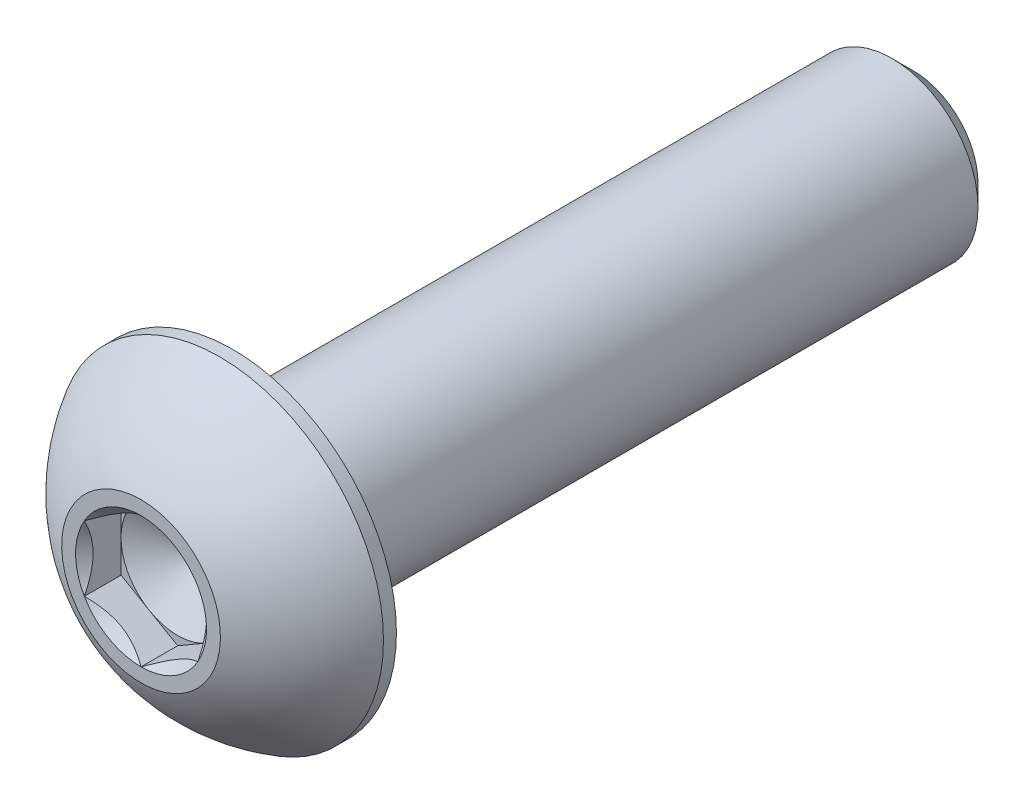
from build123d import *

# Parameters (mm, degrees)
CUT_EXTRUDE1_START = 9.78154
CUT_EXTRUDE1_DEPTH = 3.821845556


with BuildPart() as part:
    # Sketch2 → Revolve1 (revolve)
    with BuildSketch(Plane(origin=(0, 0, 0), x_dir=(0, 0, -1), z_dir=(1, 0, 0)), mode=Mode.PRIVATE) as revolve1_sk:
        with BuildLine():
            Line((-10.8077, 1.5875), (-10.8077, 2.2225))
            ThreePointArc((-10.8077, 2.2225), (-9.892752118, 3.57733025), (-8.605157143, 4.5847))
            Line((-8.605157143, 4.5847), (-8.2423, 4.5847))
            Line((-8.2423, 4.5847), (-8.2423, 2.413))
            Line((-8.2423, 2.413), (10.2123875, 2.413))
            Line((10.2123875, 2.413), (10.8077, 1.8176875))
            Line((10.8077, 1.8176875), (10.8077, 0))
            Line((10.8077, 0), (-8.864996448, 0))
            Line((-8.864996448, 0), (-9.78154, 1.5875))
            Line((-9.78154, 1.5875), (-10.8077, 1.5875))
        make_face()
    revolve(revolve1_sk.sketch.rotate(Axis((0, 0, 10.8077), (0, 0, -1)), 90), axis=Axis((0, 0, 10.8077), (0, 0, -1)))

    # Sketch3 → Cut-Extrude1 (cut, through all)
    with BuildSketch(Plane.XY.offset(CUT_EXTRUDE1_START)):
        Polygon((0, 1.833087105), (-1.5875, 0.916543552), (-1.5875, -0.916543552), (0, -1.833087105), (1.5875, -0.916543552), (1.5875, 0.916543552), align=None)
    extrude(amount=CUT_EXTRUDE1_DEPTH, mode=Mode.SUBTRACT)

    # Cut-Extrude2 cone 1 section (through the dimple's axis) → Cut-Extrude2 (revolve, cut)
    with BuildSketch(Plane(origin=(0, 0, 10.8077), x_dir=(0, -1, 0), z_dir=(1, 0, 0))):
        Polygon((0, 0), (1.833087105, 0), (0, 1.833087105), align=None)
    revolve(axis=Axis((0, 0, 10.8077), (0, 0, -1)), mode=Mode.SUBTRACT)


solid = part.part
